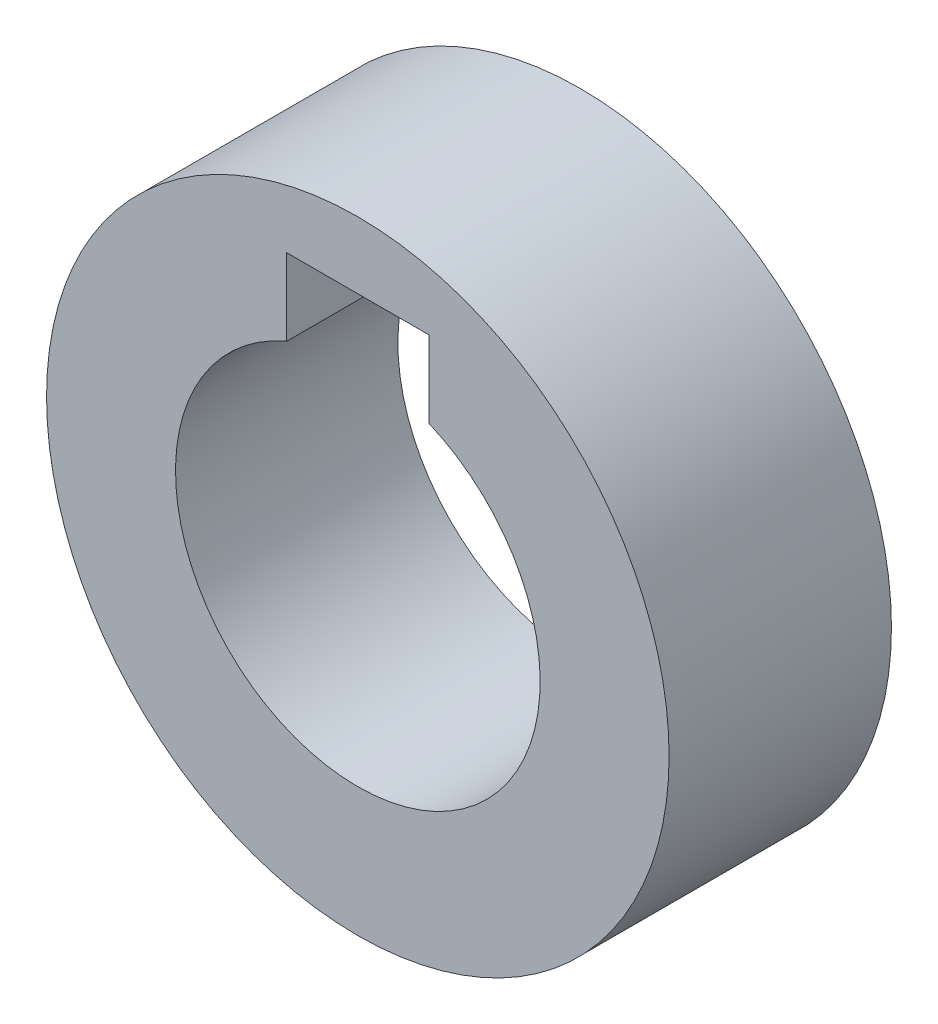
from build123d import *

# Parameters (mm, degrees)
SKETCH1_R           = 7
BOSS_EXTRUDE1_DEPTH = 5


with BuildPart() as part:
    # Sketch1 → Boss-Extrude1 (new body)
    with BuildSketch(Plane.XY):
        Circle(SKETCH1_R)
        with BuildLine():
            Line((-1.6, 3.774917218), (-1.6, 5.5))
            Line((-1.6, 5.5), (1.6, 5.5))
            Line((1.6, 5.5), (1.6, 3.774917218))
            ThreePointArc((1.6, 3.774917218), (0, -4.1), (-1.6, 3.774917218))
        make_face(mode=Mode.SUBTRACT)
    extrude(amount=BOSS_EXTRUDE1_DEPTH)


solid = part.part
